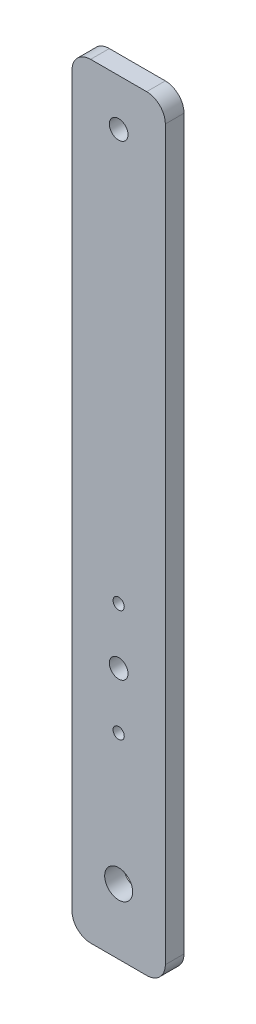
from build123d import *

# Parameters (mm, degrees)
SKETCH1_W           = 50
SKETCH1_H           = 410
SKETCH1_R           = 5
SKETCH1_R_2         = 3
BOSS_EXTRUDE1_DEPTH = 10
FILLET1_R           = 10
SKETCH2_R           = 7.5
CUT_EXTRUDE1_DEPTH  = 10


with BuildPart() as part:
    # Sketch1 → Boss-Extrude1 (new body)
    with BuildSketch(Plane.XY):
        with Locations((25, -205)):
            Rectangle(SKETCH1_W, SKETCH1_H)
        with Locations((25, -275)):
            Circle(SKETCH1_R, mode=Mode.SUBTRACT)
        with Locations((25, -25)):
            Circle(SKETCH1_R, mode=Mode.SUBTRACT)
        with Locations((25, -245)):
            Circle(SKETCH1_R_2, mode=Mode.SUBTRACT)
        with Locations((25, -305)):
            Circle(SKETCH1_R_2, mode=Mode.SUBTRACT)
    extrude(amount=BOSS_EXTRUDE1_DEPTH)

    # Fillet1
    fillet1_edges = [part.edges().sort_by_distance(p)[0] for p in [
        (0, 0, 5),
        (50, 0, 5),
        (50, -410, 5),
        (0, -410, 5),
    ]]
    fillet(fillet1_edges, radius=FILLET1_R)

    # Sketch2 → Cut-Extrude1 (cut)
    with BuildSketch(Plane.XY.offset(10)):
        with Locations((25, -375)):
            Circle(SKETCH2_R)
    extrude(amount=-CUT_EXTRUDE1_DEPTH, mode=Mode.SUBTRACT)


solid = part.part
